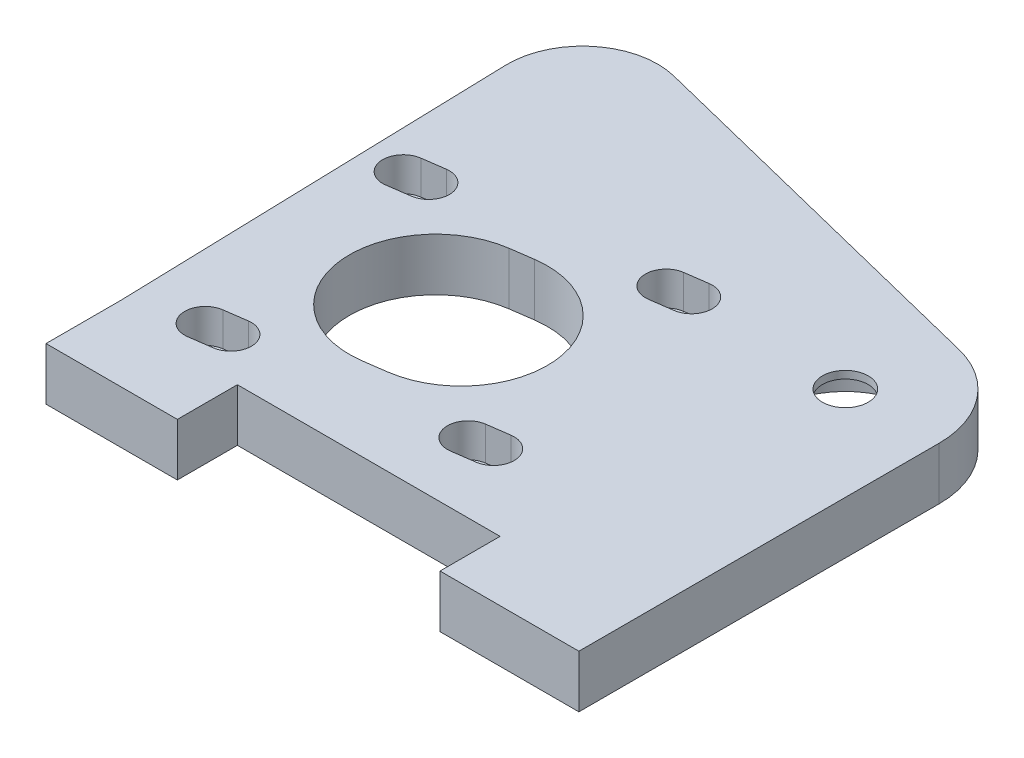
from build123d import *

# Parameters (mm, degrees)
SKETCH2_R           = 3.05
BOSS_EXTRUDE1_DEPTH = 7
SKETCH2_7_R         = 9.5
SKETCH2_7_R_2       = 3.05
CUT_EXTRUDE1_DEPTH  = 6
CUT_EXTRUDE2_START  = 7
CUT_EXTRUDE2_DEPTH  = 4.5


with BuildPart() as part:
    # Sketch2 → Boss-Extrude1 (new body)
    with BuildSketch(Plane(origin=(0, 0, 0), x_dir=(1, 0, 0), z_dir=(0, 1, 0))):
        with BuildLine():
            Line((102.512048312, 24.992099408), (102.512048312, -23.007900592))
            Line((102.512048312, -23.007900592), (84.012048312, -23.007900592))
            Line((84.012048312, -23.007900592), (84.012048312, -15.007900592))
            Line((84.012048312, -15.007900592), (49.012048312, -15.007900592))
            Line((49.012048312, -15.007900592), (49.012048312, -23.007900592))
            Line((49.012048312, -23.007900592), (31.512048312, -23.007900592))
            Line((31.512048312, -23.007900592), (31.512048312, -13.007900592))
            Line((31.512048312, -13.007900592), (30.016072392, 39.708435169))
            ThreePointArc((30.016072392, 39.708435169), (33.741164308, 47.78158038), (42.423514406, 49.696986387))
            Line((42.423514406, 49.696986387), (93.026380929, 37.123208132))
            ThreePointArc((93.026380929, 37.123208132), (99.859107713, 32.691802074), (102.512048312, 24.992099408))
        make_face()
        with Locations(Location((90.012048312, 24.992099408, 0), (0, 0, 270))):
            Circle(SKETCH2_R, mode=Mode.SUBTRACT)
        with BuildLine():
            Line((51.378851017, 18.833843692), (54.349655223, 19.251362995))
            ThreePointArc((54.349655223, 19.251362995), (67.338228674, 9.463770865), (57.550636545, -3.524802586))
            Line((57.550636545, -3.524802586), (54.579832339, -3.942321889))
            ThreePointArc((54.579832339, -3.942321889), (41.591258887, 5.84527024), (51.378851017, 18.833843692))
        make_face(mode=Mode.SUBTRACT)
        with BuildLine():
            Line((65.962554027, 26.437501135), (68.933358233, 26.855020438))
            ThreePointArc((68.933358233, 26.855020438), (70.627519988, 25.578377986), (69.350877536, 23.884216232))
            Line((69.350877536, 23.884216232), (66.38007333, 23.466696929))
            ThreePointArc((66.38007333, 23.466696929), (64.685911575, 24.74333938), (65.962554027, 26.437501135))
        make_face(mode=Mode.SUBTRACT)
        with BuildLine():
            Line((70.694439459, -7.231613202), (73.665243666, -6.814093899))
            ThreePointArc((73.665243666, -6.814093899), (74.941886117, -5.119932145), (73.247724363, -3.843289693))
            Line((73.247724363, -3.843289693), (70.276920157, -4.260808996))
            ThreePointArc((70.276920157, -4.260808996), (69.000277705, -5.954970751), (70.694439459, -7.231613202))
        make_face(mode=Mode.SUBTRACT)
        with BuildLine():
            Line((42.966933535, -11.128460029), (39.996129329, -11.545979332))
            ThreePointArc((39.996129329, -11.545979332), (38.301967574, -10.26933688), (39.578610026, -8.575175126))
            Line((39.578610026, -8.575175126), (42.549414232, -8.157655823))
            ThreePointArc((42.549414232, -8.157655823), (44.243575986, -9.434298275), (42.966933535, -11.128460029))
        make_face(mode=Mode.SUBTRACT)
        with BuildLine():
            Line((38.235048102, 22.540654308), (35.264243896, 22.123135005))
            ThreePointArc((35.264243896, 22.123135005), (33.987601444, 20.428973251), (35.681763199, 19.152330799))
            Line((35.681763199, 19.152330799), (38.652567405, 19.569850102))
            ThreePointArc((38.652567405, 19.569850102), (39.929209857, 21.264011856), (38.235048102, 22.540654308))
        make_face(mode=Mode.SUBTRACT)
    extrude(amount=BOSS_EXTRUDE1_DEPTH)

    # Sketch2<7> → Cut-Extrude1 (cut)
    with BuildSketch(Plane(origin=(0, 0, 0), x_dir=(1, 0, 0), z_dir=(0, 1, 0))):
        with Locations(Location((90.012048312, 24.992099408, 0), (0, 0, 270))):
            Circle(SKETCH2_7_R)
        with Locations(Location((90.012048312, 24.992099408, 0), (0, 0, 270))):
            Circle(SKETCH2_7_R_2, mode=Mode.SUBTRACT)
    extrude(amount=CUT_EXTRUDE1_DEPTH, mode=Mode.SUBTRACT)

    # Sketch2<8> → Cut-Extrude2 (cut)
    with BuildSketch(Plane(origin=(0, 0, 0), x_dir=(1, 0, 0), z_dir=(0, 1, 0)).offset(CUT_EXTRUDE2_START)):
        with BuildLine():
            Line((65.788587651, 27.675336221), (68.759391857, 28.092855524))
            ThreePointArc((68.759391857, 28.092855524), (71.865355074, 25.752344362), (69.524843912, 22.646381146))
            Line((69.524843912, 22.646381146), (66.554039706, 22.228861843))
            ThreePointArc((66.554039706, 22.228861843), (63.448076489, 24.569373004), (65.788587651, 27.675336221))
        make_face()
        with BuildLine():
            Line((70.868405836, -8.469448288), (73.839210042, -8.051928985))
            ThreePointArc((73.839210042, -8.051928985), (76.179721203, -4.945965769), (73.073757987, -2.605454607))
            Line((73.073757987, -2.605454607), (70.10295378, -3.02297391))
            ThreePointArc((70.10295378, -3.02297391), (67.762442619, -6.128937127), (70.868405836, -8.469448288))
        make_face()
        with BuildLine():
            Line((38.061081726, 23.778489394), (35.09027752, 23.360970091))
            ThreePointArc((35.09027752, 23.360970091), (32.749766358, 20.255006874), (35.855729575, 17.914495713))
            Line((35.855729575, 17.914495713), (38.826533781, 18.332015016))
            ThreePointArc((38.826533781, 18.332015016), (41.167044943, 21.437978232), (38.061081726, 23.778489394))
        make_face()
        with BuildLine():
            Line((42.375447856, -6.919820737), (39.404643649, -7.33734004))
            ThreePointArc((39.404643649, -7.33734004), (37.064132488, -10.443303257), (40.170095705, -12.783814418))
            Line((40.170095705, -12.783814418), (43.140899911, -12.366295115))
            ThreePointArc((43.140899911, -12.366295115), (45.481411072, -9.260331898), (42.375447856, -6.919820737))
        make_face()
    extrude(amount=-CUT_EXTRUDE2_DEPTH, mode=Mode.SUBTRACT)


solid = part.part
